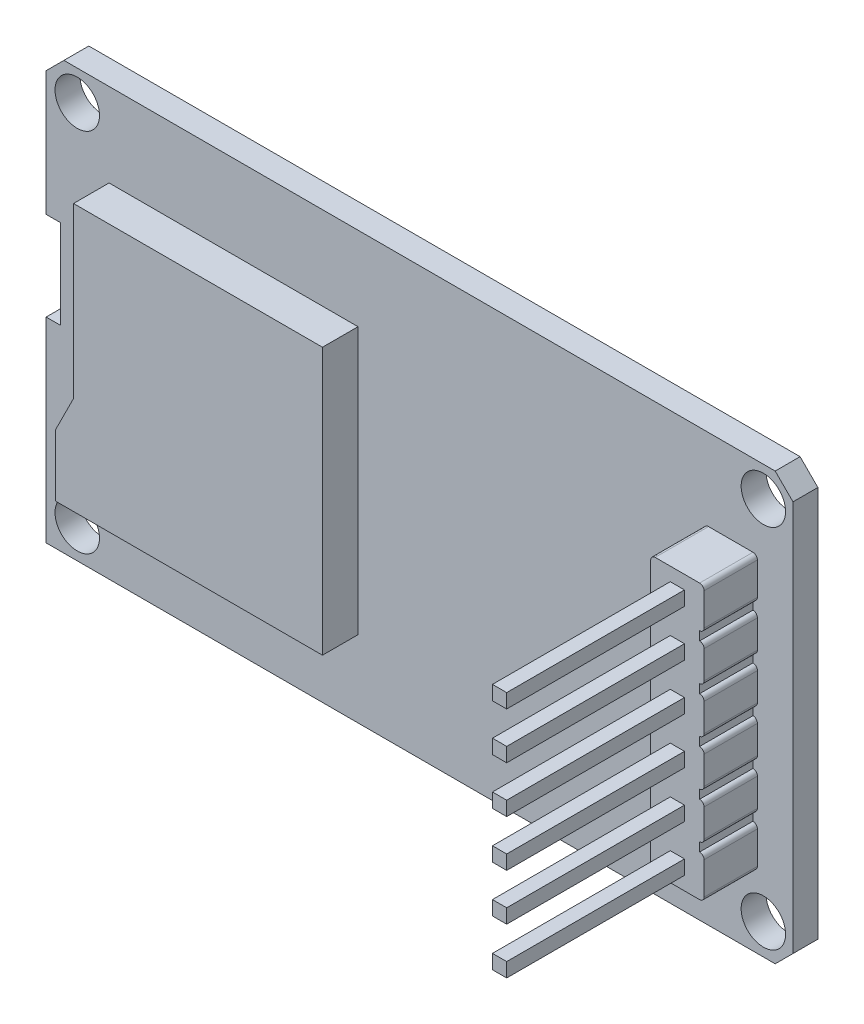
from build123d import *

# Parameters (mm, degrees)
BOSS_EXTRUDE1_DEPTH        = 1.4
F_2_5_2_5_DIAMETER_SLOT1_D = 2.5
BOSS_EXTRUDE2_DEPTH        = 2
BOSS_EXTRUDE3_DEPTH        = 3
SKETCH8_W                  = 0.8
SKETCH8_H                  = 0.8
BOSS_EXTRUDE4_DEPTH        = 10


with BuildPart() as part:
    # Sketch1 → Boss-Extrude1 (new body)
    with BuildSketch(Plane.XY):
        Polygon((-17.623529412, 12), (-16.623529412, 13), (23.376470588, 13), (24.376470588, 12), (24.376470588, -10), (23.376470588, -11), (-17.623529412, -11), (-17.623529412, 0), (-16.823529412, 0), (-16.823529412, 5), (-17.623529412, 5), align=None)
    extrude(amount=BOSS_EXTRUDE1_DEPTH)

    # Ø2.5 (2.5) Diameter Slot1 (through all)
    with Locations(Plane.XY.offset(1.4)):
        with Locations((-15.874285672, -9.269193445), (-15.874285672, 11.312714255), (22.710754066, -9.269193445), (22.710754066, 11.312714255)):
            Hole(F_2_5_2_5_DIAMETER_SLOT1_D / 2)

    # Sketch6 → Boss-Extrude2 (add)
    with BuildSketch(Plane.XY.offset(1.4)):
        Polygon((-15.083529412, -6.7), (-0.083529412, -6.7), (-0.083529412, 8.3), (-14.083529412, 8.3), (-14.083529412, -1.2), (-15.083529412, -3.2), align=None)
    extrude(amount=BOSS_EXTRUDE2_DEPTH)

    # Sketch7 → Boss-Extrude3 (add)
    with BuildSketch(Plane.XY.offset(1.4)):
        with BuildLine():
            Line((22.126470588, 6.1), (22.126470588, 5.6))
            ThreePointArc((22.126470588, 5.6), (22.303247284, 5.526776695), (22.376470588, 5.35))
            Line((22.376470588, 5.35), (22.376470588, 3.78))
            ThreePointArc((22.376470588, 3.78), (22.303247284, 3.603223305), (22.126470588, 3.53))
            Line((22.126470588, 3.53), (22.126470588, 3.03))
            ThreePointArc((22.126470588, 3.03), (22.303247284, 2.956776695), (22.376470588, 2.78))
            Line((22.376470588, 2.78), (22.376470588, 1.21))
            ThreePointArc((22.376470588, 1.21), (22.303247284, 1.033223305), (22.126470588, 0.96))
            Line((22.126470588, 0.96), (22.126470588, 0.46))
            ThreePointArc((22.126470588, 0.46), (22.303247284, 0.386776695), (22.376470588, 0.21))
            Line((22.376470588, 0.21), (22.376470588, -1.36))
            ThreePointArc((22.376470588, -1.36), (22.303247284, -1.536776695), (22.126470588, -1.61))
            Line((22.126470588, -1.61), (22.126470588, -2.11))
            ThreePointArc((22.126470588, -2.11), (22.303247284, -2.183223305), (22.376470588, -2.36))
            Line((22.376470588, -2.36), (22.376470588, -3.93))
            ThreePointArc((22.376470588, -3.93), (22.303247284, -4.106776695), (22.126470588, -4.18))
            Line((22.126470588, -4.18), (22.126470588, -4.68))
            ThreePointArc((22.126470588, -4.68), (22.303247284, -4.753223305), (22.376470588, -4.93))
            Line((22.376470588, -4.93), (22.376470588, -6.75))
            ThreePointArc((22.376470588, -6.75), (22.303247284, -6.926776695), (22.126470588, -7))
            Line((22.126470588, -7), (19.626470588, -7))
            ThreePointArc((19.626470588, -7), (19.449693893, -6.926776695), (19.376470588, -6.75))
            Line((19.376470588, -6.75), (19.376470588, -4.93))
            ThreePointArc((19.376470588, -4.93), (19.449693893, -4.753223305), (19.626470588, -4.68))
            Line((19.626470588, -4.68), (19.626470588, -4.18))
            ThreePointArc((19.626470588, -4.18), (19.449693893, -4.106776695), (19.376470588, -3.93))
            Line((19.376470588, -3.93), (19.376470588, -2.36))
            ThreePointArc((19.376470588, -2.36), (19.449693893, -2.183223305), (19.626470588, -2.11))
            Line((19.626470588, -2.11), (19.626470588, -1.61))
            ThreePointArc((19.626470588, -1.61), (19.449693893, -1.536776695), (19.376470588, -1.36))
            Line((19.376470588, -1.36), (19.376470588, 0.21))
            ThreePointArc((19.376470588, 0.21), (19.449693893, 0.386776695), (19.626470588, 0.46))
            Line((19.626470588, 0.46), (19.626470588, 0.96))
            ThreePointArc((19.626470588, 0.96), (19.449693893, 1.033223305), (19.376470588, 1.21))
            Line((19.376470588, 1.21), (19.376470588, 2.78))
            ThreePointArc((19.376470588, 2.78), (19.449693893, 2.956776695), (19.626470588, 3.03))
            Line((19.626470588, 3.03), (19.626470588, 3.53))
            ThreePointArc((19.626470588, 3.53), (19.449693893, 3.603223305), (19.376470588, 3.78))
            Line((19.376470588, 3.78), (19.376470588, 5.35))
            ThreePointArc((19.376470588, 5.35), (19.449693893, 5.526776695), (19.626470588, 5.6))
            Line((19.626470588, 5.6), (19.626470588, 6.1))
            ThreePointArc((19.626470588, 6.1), (19.449693893, 6.173223305), (19.376470588, 6.35))
            Line((19.376470588, 6.35), (19.376470588, 8.17))
            ThreePointArc((19.376470588, 8.17), (19.449693893, 8.346776695), (19.626470588, 8.42))
            Line((19.626470588, 8.42), (22.126470588, 8.42))
            ThreePointArc((22.126470588, 8.42), (22.303247284, 8.346776695), (22.376470588, 8.17))
            Line((22.376470588, 8.17), (22.376470588, 6.35))
            ThreePointArc((22.376470588, 6.35), (22.303247284, 6.173223305), (22.126470588, 6.1))
        make_face()
    extrude(amount=BOSS_EXTRUDE3_DEPTH)

    # Sketch8 → Boss-Extrude4 (add)
    with BuildSketch(Plane.XY.offset(4.4)):
        with Locations((20.876470588, -5.84)):
            Rectangle(SKETCH8_W, SKETCH8_H)
        with Locations((20.876470588, -3.22)):
            Rectangle(SKETCH8_W, SKETCH8_H)
        with Locations((20.876470588, -0.6)):
            Rectangle(SKETCH8_W, SKETCH8_H)
        with Locations((20.876470588, 2.02)):
            Rectangle(SKETCH8_W, SKETCH8_H)
        with Locations((20.876470588, 4.64)):
            Rectangle(SKETCH8_W, SKETCH8_H)
        with Locations((20.876470588, 7.26)):
            Rectangle(SKETCH8_W, SKETCH8_H)
    extrude(amount=BOSS_EXTRUDE4_DEPTH)


solid = part.part
